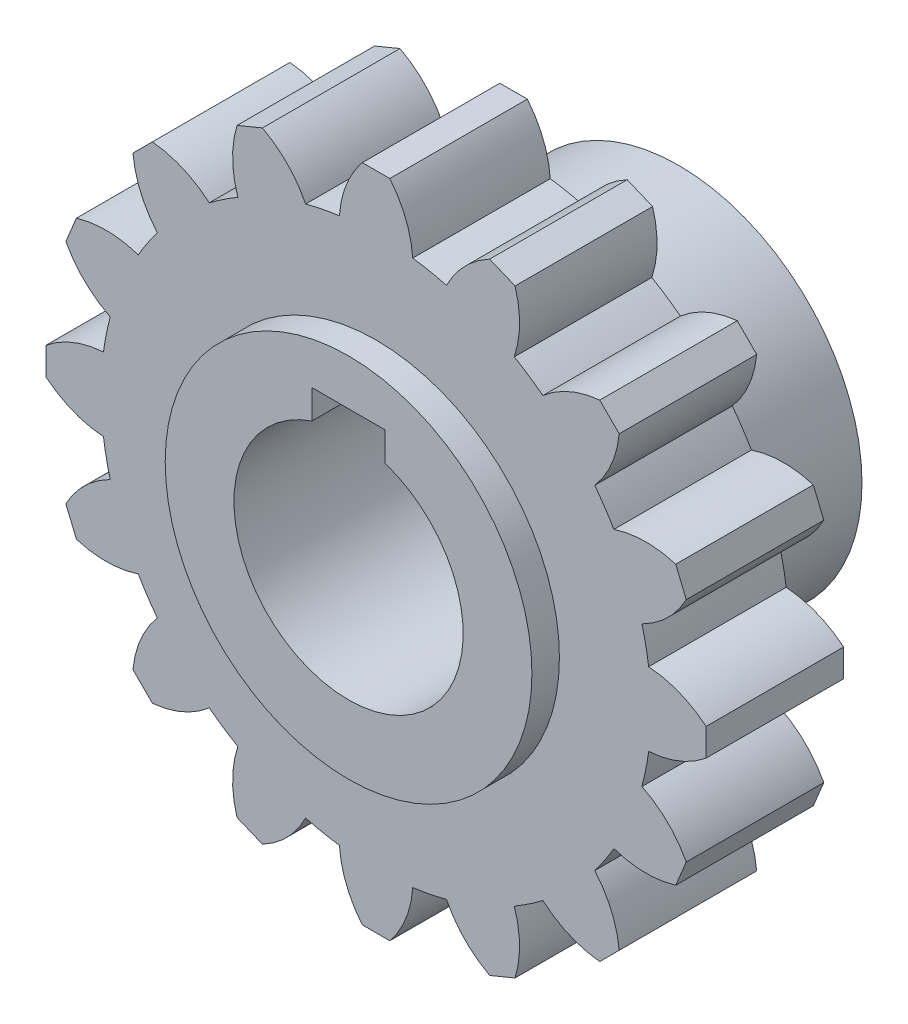
from build123d import *

# Parameters (mm, degrees)
SKETCH1_R           = 30
BOSS_EXTRUDE1_DEPTH = 15
SKETCH2_R           = 20
BOSS_EXTRUDE2_DEPTH = 3
BOSS_EXTRUDE3_START = 18
SKETCH3_R           = 20
BOSS_EXTRUDE3_DEPTH = 18
CUT_EXTRUDE1_DEPTH  = 56.641710973
BOSS_EXTRUDE5_DEPTH = 7.5


with BuildPart() as part:
    # Sketch1 → Boss-Extrude1 (new body)
    with BuildSketch(Plane.XY):
        Circle(SKETCH1_R)
    extrude(amount=BOSS_EXTRUDE1_DEPTH)

    # Sketch2 → Boss-Extrude2 (add)
    with BuildSketch(Plane.XY.offset(15)):
        Circle(SKETCH2_R)
    extrude(amount=BOSS_EXTRUDE2_DEPTH)

    # Sketch3 → Boss-Extrude3 (add)
    with BuildSketch(Plane(origin=(0, 0, 0), x_dir=(-1, 0, 0), z_dir=(0, 0, -1)).offset(BOSS_EXTRUDE3_START)):
        with Locations(Location((0, 0, 0), (0, 0, 180))):
            Circle(SKETCH3_R)
    extrude(amount=-BOSS_EXTRUDE3_DEPTH)

    # Sketch4 → Cut-Extrude1 (cut, through all)
    with BuildSketch(Plane(origin=(0, 0, -18), x_dir=(-1, 0, 0), z_dir=(0, 0, -1))):
        with BuildLine():
            Line((-4, 15), (4, 15))
            Line((4, 15), (4, 11.842719282))
            ThreePointArc((4, 11.842719282), (0, -12.5), (-4, 11.842719282))
            Line((-4, 11.842719282), (-4, 15))
        make_face()
    extrude(amount=-CUT_EXTRUDE1_DEPTH, mode=Mode.SUBTRACT)

    # Sketch5 → Boss-Extrude5 (add, symmetric)
    with BuildSketch(Plane.XY.offset(7.5)):
        with BuildLine():
            Line((-1.5, 36), (1.5, 36))
            ThreePointArc((1.5, 36), (3.242504384, 33.062509074), (4, 29.732137495))
            ThreePointArc((4, 29.732137495), (0, 30), (-4, 29.732137495))
            ThreePointArc((-4, 29.732137495), (-3.242504384, 33.062509074), (-1.5, 36))
        make_face()
        with BuildLine():
            Line((12.390784266, 33.833688319), (15.162422864, 32.685638022))
            ThreePointArc((15.162422864, 32.685638022), (15.64815789, 29.30492272), (15.073514558, 25.93817956))
            ThreePointArc((15.073514558, 25.93817956), (11.480502971, 27.716385975), (7.682478298, 28.999647019))
            ThreePointArc((7.682478298, 28.999647019), (9.656791021, 31.786628134), (12.390784266, 33.833688319))
        make_face()
        with BuildLine():
            Line((24.395183951, 26.516504294), (26.516504295, 24.395183951))
            ThreePointArc((26.516504295, 24.395183951), (25.671521208, 21.085927531), (23.852223166, 18.195368917))
            ThreePointArc((23.852223166, 18.195368917), (21.213203436, 21.213203436), (18.195368917, 23.852223166))
            ThreePointArc((18.195368917, 23.852223166), (21.085927531, 25.671521208), (24.395183951, 26.516504294))
        make_face()
        with BuildLine():
            Line((32.685638022, 15.162422864), (33.833688319, 12.390784266))
            ThreePointArc((33.833688319, 12.390784266), (31.786628135, 9.656791021), (28.999647019, 7.682478298))
            ThreePointArc((28.999647019, 7.682478298), (27.716385975, 11.480502971), (25.93817956, 15.073514558))
            ThreePointArc((25.93817956, 15.073514558), (29.30492272, 15.64815789), (32.685638022, 15.162422864))
        make_face()
        with BuildLine():
            Line((36, 1.5), (36, -1.5))
            ThreePointArc((36, -1.5), (33.062509074, -3.242504384), (29.732137495, -4))
            ThreePointArc((29.732137495, -4), (30, 0), (29.732137495, 4))
            ThreePointArc((29.732137495, 4), (33.062509074, 3.242504384), (36, 1.5))
        make_face()
        with BuildLine():
            Line((33.833688319, -12.390784266), (32.685638022, -15.162422864))
            ThreePointArc((32.685638022, -15.162422864), (29.30492272, -15.64815789), (25.93817956, -15.073514558))
            ThreePointArc((25.93817956, -15.073514558), (27.716385975, -11.480502971), (28.999647019, -7.682478298))
            ThreePointArc((28.999647019, -7.682478298), (31.786628135, -9.656791021), (33.833688319, -12.390784266))
        make_face()
        with BuildLine():
            Line((26.516504295, -24.395183951), (24.395183951, -26.516504295))
            ThreePointArc((24.395183951, -26.516504295), (21.085927531, -25.671521208), (18.195368917, -23.852223166))
            ThreePointArc((18.195368917, -23.852223166), (21.213203436, -21.213203436), (23.852223166, -18.195368917))
            ThreePointArc((23.852223166, -18.195368917), (25.671521208, -21.085927531), (26.516504295, -24.395183951))
        make_face()
        with BuildLine():
            Line((15.162422864, -32.685638022), (12.390784266, -33.833688319))
            ThreePointArc((12.390784266, -33.833688319), (9.656791021, -31.786628135), (7.682478298, -28.999647019))
            ThreePointArc((7.682478298, -28.999647019), (11.480502971, -27.716385975), (15.073514558, -25.93817956))
            ThreePointArc((15.073514558, -25.93817956), (15.64815789, -29.30492272), (15.162422864, -32.685638022))
        make_face()
        with BuildLine():
            Line((1.5, -36), (-1.5, -36))
            ThreePointArc((-1.5, -36), (-3.242504384, -33.062509074), (-4, -29.732137495))
            ThreePointArc((-4, -29.732137495), (0, -30), (4, -29.732137495))
            ThreePointArc((4, -29.732137495), (3.242504384, -33.062509074), (1.5, -36))
        make_face()
        with BuildLine():
            Line((-12.390784266, -33.833688319), (-15.162422864, -32.685638022))
            ThreePointArc((-15.162422864, -32.685638022), (-15.64815789, -29.30492272), (-15.073514558, -25.93817956))
            ThreePointArc((-15.073514558, -25.93817956), (-11.480502971, -27.716385975), (-7.682478298, -28.999647019))
            ThreePointArc((-7.682478298, -28.999647019), (-9.656791021, -31.786628135), (-12.390784266, -33.833688319))
        make_face()
        with BuildLine():
            Line((-24.395183951, -26.516504295), (-26.516504295, -24.395183951))
            ThreePointArc((-26.516504295, -24.395183951), (-25.671521208, -21.085927531), (-23.852223166, -18.195368917))
            ThreePointArc((-23.852223166, -18.195368917), (-21.213203436, -21.213203436), (-18.195368917, -23.852223166))
            ThreePointArc((-18.195368917, -23.852223166), (-21.085927531, -25.671521208), (-24.395183951, -26.516504295))
        make_face()
        with BuildLine():
            Line((-32.685638022, -15.162422864), (-33.833688319, -12.390784266))
            ThreePointArc((-33.833688319, -12.390784266), (-31.786628135, -9.656791021), (-28.999647019, -7.682478298))
            ThreePointArc((-28.999647019, -7.682478298), (-27.716385975, -11.480502971), (-25.93817956, -15.073514558))
            ThreePointArc((-25.93817956, -15.073514558), (-29.30492272, -15.64815789), (-32.685638022, -15.162422864))
        make_face()
        with BuildLine():
            Line((-36, -1.5), (-36, 1.5))
            ThreePointArc((-36, 1.5), (-33.062509074, 3.242504384), (-29.732137495, 4))
            ThreePointArc((-29.732137495, 4), (-30, 0), (-29.732137495, -4))
            ThreePointArc((-29.732137495, -4), (-33.062509074, -3.242504384), (-36, -1.5))
        make_face()
        with BuildLine():
            Line((-33.833688319, 12.390784266), (-32.685638022, 15.162422864))
            ThreePointArc((-32.685638022, 15.162422864), (-29.30492272, 15.64815789), (-25.93817956, 15.073514558))
            ThreePointArc((-25.93817956, 15.073514558), (-27.716385975, 11.480502971), (-28.999647019, 7.682478298))
            ThreePointArc((-28.999647019, 7.682478298), (-31.786628135, 9.656791021), (-33.833688319, 12.390784266))
        make_face()
        with BuildLine():
            Line((-26.516504295, 24.395183951), (-24.395183951, 26.516504294))
            ThreePointArc((-24.395183951, 26.516504294), (-21.085927531, 25.671521208), (-18.195368917, 23.852223166))
            ThreePointArc((-18.195368917, 23.852223166), (-21.213203436, 21.213203436), (-23.852223166, 18.195368917))
            ThreePointArc((-23.852223166, 18.195368917), (-25.671521208, 21.085927531), (-26.516504295, 24.395183951))
        make_face()
        with BuildLine():
            Line((-15.162422864, 32.685638022), (-12.390784266, 33.833688319))
            ThreePointArc((-12.390784266, 33.833688319), (-9.656791021, 31.786628134), (-7.682478298, 28.999647019))
            ThreePointArc((-7.682478298, 28.999647019), (-11.480502971, 27.716385975), (-15.073514558, 25.93817956))
            ThreePointArc((-15.073514558, 25.93817956), (-15.64815789, 29.30492272), (-15.162422864, 32.685638022))
        make_face()
    extrude(amount=BOSS_EXTRUDE5_DEPTH, both=True)


solid = part.part
